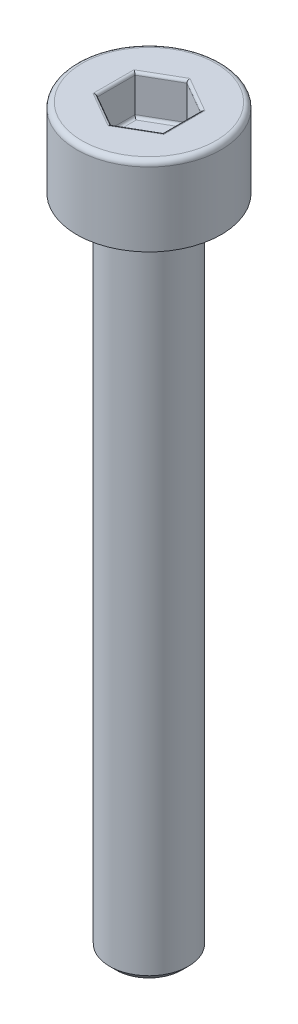
from build123d import *

# Parameters (mm, degrees)
CHAMFER1_SIZE      = 0.25
FILLET1_R          = 0.2
CUT_EXTRUDE1_DEPTH = 1.5
FILLET2_R          = 0.1


with BuildPart() as part:
    # Sketch1 → Revolve1 (revolve)
    with BuildSketch(Plane.XY, mode=Mode.PRIVATE) as revolve1_sk:
        Polygon((0, -28), (-1.5, -28), (-1.5, -3), (-2.75, -3), (-2.75, 0), (0, 0), align=None)
    revolve(revolve1_sk.sketch.rotate(Axis((0, 0, 0), (0, -1, 0)), 270), axis=Axis((0, 0, 0), (0, -1, 0)))

    # Chamfer1
    chamfer1_edges = [part.edges().sort_by_distance(p)[0] for p in [
        (0, -3, -1.5),
        (0, -28, -1.5),
    ]]
    chamfer(chamfer1_edges, length=CHAMFER1_SIZE)

    # Fillet1
    fillet1_edges = [part.edges().sort_by_distance(p)[0] for p in [
        (0, 0, -2.75),
    ]]
    fillet(fillet1_edges, radius=FILLET1_R)

    # Sketch2 → Cut-Extrude1 (cut)
    with BuildSketch(Plane(origin=(0, 0, 0), x_dir=(1, 0, 0), z_dir=(0, 1, 0))):
        Polygon((0, 1.443375673), (-1.25, 0.721687836), (-1.25, -0.721687836), (0, -1.443375673), (1.25, -0.721687836), (1.25, 0.721687836), align=None)
    extrude(amount=-CUT_EXTRUDE1_DEPTH, mode=Mode.SUBTRACT)

    # Fillet2
    fillet2_edges = [part.edges().sort_by_distance(p)[0] for p in [
        (0.625, -1.5, -1.082531755),
        (1.25, -1.5, 0),
        (0.625, -1.5, 1.082531755),
        (-0.625, -1.5, 1.082531755),
        (-1.25, -1.5, 0),
        (-0.625, -1.5, -1.082531755),
        (0.625, 0, -1.082531755),
        (-0.625, 0, -1.082531755),
        (-1.25, 0, 0),
        (-0.625, 0, 1.082531755),
        (0.625, 0, 1.082531755),
        (1.25, 0, 0),
    ]]
    fillet(fillet2_edges, radius=FILLET2_R)


solid = part.part
